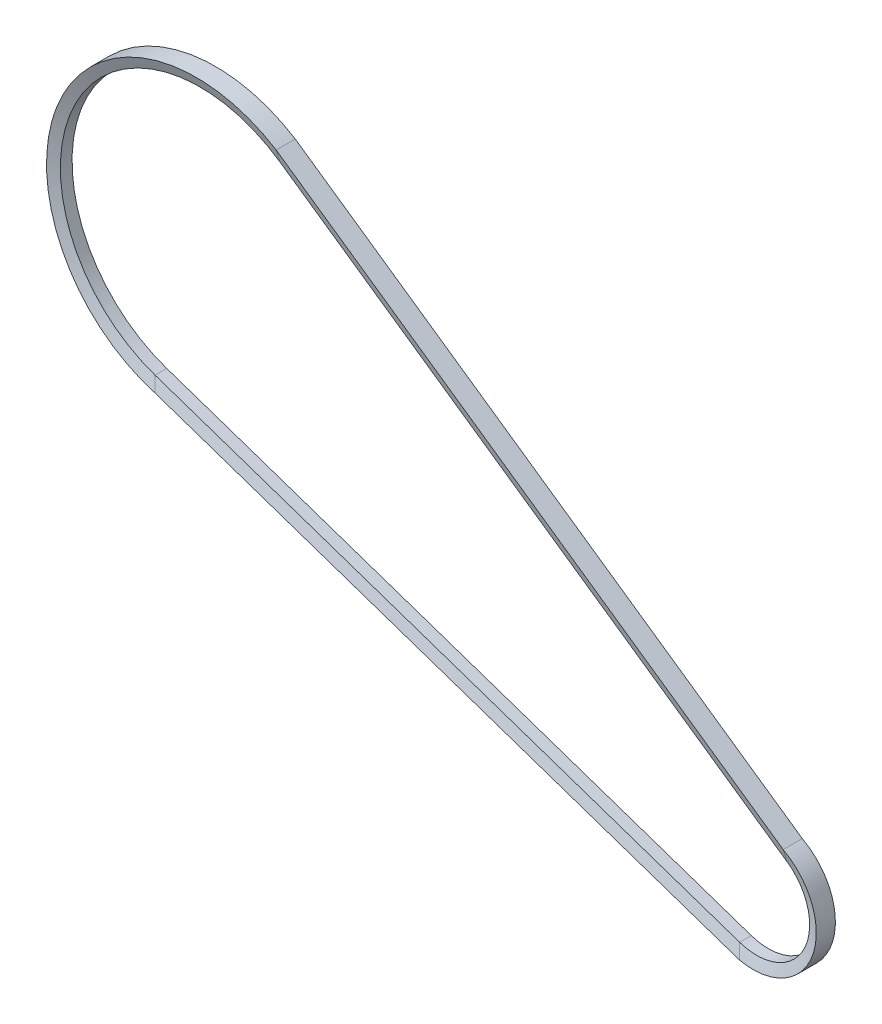
from build123d import *


with BuildPart() as part:
    # Sweep1: sweep along a path in Sketch2
    with BuildLine(Plane.XY) as sweep1_path:
        Line((91.876015198, 132.211186484), (676.000167258, -273.707562894))
        ThreePointArc((676.000167258, -273.707562894), (695.640754943, -351.297550576), (621.540601776, -381.548603015))
        Line((621.540601776, -381.548603015), (-51.861526484, -152.418443998))
        ThreePointArc((-51.861526484, -152.418443998), (-143.71428761, 72.575502314), (91.876015198, 132.211186484))
    # Sketch3 → Sweep1 (sweep)
    with BuildSketch(Plane(origin=(91.876015198, 0, 0), x_dir=(0, 0, -1), z_dir=(1, 0, 0))):
        Polygon((-6.72, 132.211186484), (6.72, 132.211186484), (11, 146.210435691), (-11, 146.210435691), align=None)
    sweep(path=sweep1_path.line)


solid = part.part
